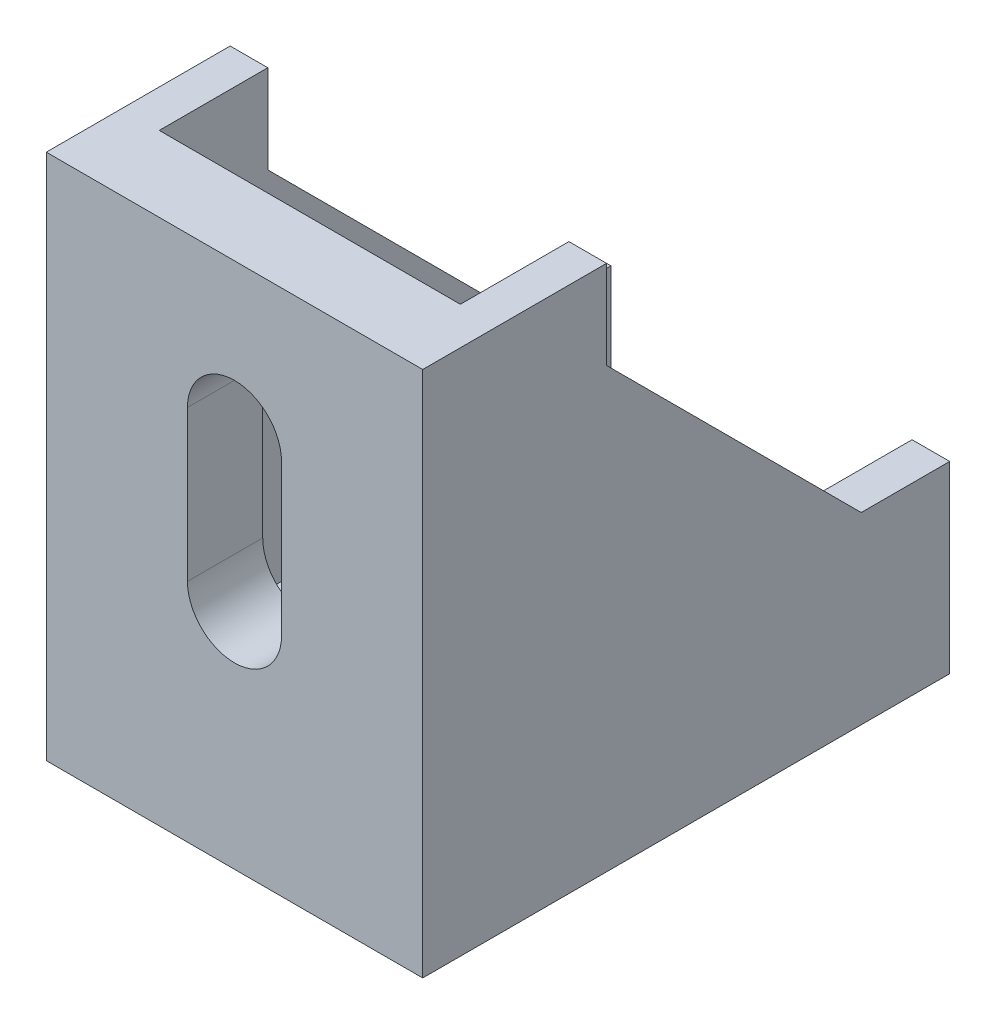
from build123d import *

# Parameters (mm, degrees)
BOSS_EXTRUDE2_DEPTH = 20
BOSS_EXTRUDE3_DEPTH = 2
BOSS_EXTRUDE4_START = 20
BOSS_EXTRUDE4_DEPTH = 2
CUT_EXTRUDE1_DEPTH  = 42.952353927
CUT_EXTRUDE2_DEPTH  = 42.952353927


with BuildPart() as part:
    # Sketch1 → Boss-Extrude2 (new body)
    with BuildSketch(Plane(origin=(0, 0, 0), x_dir=(0, 0, -1), z_dir=(1, 0, 0))):
        Polygon((0, 28), (0, 0), (28, 0), (28, 4), (4, 4), (4, 28), align=None)
    extrude(amount=BOSS_EXTRUDE2_DEPTH)

    # Sketch1<4> → Boss-Extrude3 (add)
    with BuildSketch(Plane(origin=(0, 0, 0), x_dir=(0, 0, -1), z_dir=(1, 0, 0))):
        Polygon((9.768810499, 28), (4, 28), (4, 4), (28, 4), (28, 9.768810499), (23.299944734, 9.768810499), (9.768810499, 23.299944734), align=None)
    extrude(amount=BOSS_EXTRUDE3_DEPTH)

    # Sketch1<5> → Boss-Extrude4 (add)
    with BuildSketch(Plane(origin=(0, 0, 0), x_dir=(0, 0, -1), z_dir=(1, 0, 0)).offset(BOSS_EXTRUDE4_START)):
        Polygon((9.768810499, 28), (4, 28), (4, 4), (28, 4), (28, 9.768810499), (23.299944734, 9.768810499), (9.768810499, 23.299944734), align=None)
    extrude(amount=-BOSS_EXTRUDE4_DEPTH)

    # Sketch2 → Cut-Extrude1 (cut, through all)
    with BuildSketch(Plane(origin=(0, 4, 0), x_dir=(1, 0, 0), z_dir=(0, 1, 0))):
        with BuildLine():
            Line((7.5, 12), (7.5, 20))
            ThreePointArc((7.5, 20), (10, 22.5), (12.5, 20))
            Line((12.5, 20), (12.5, 12))
            ThreePointArc((12.5, 12), (10, 9.5), (7.5, 12))
        make_face()
    extrude(amount=-CUT_EXTRUDE1_DEPTH, mode=Mode.SUBTRACT)

    # Sketch4 → Cut-Extrude2 (cut, through all)
    with BuildSketch(Plane(origin=(0, 0, -4), x_dir=(-1, 0, 0), z_dir=(0, 0, -1))):
        with BuildLine():
            Line((-12.5, 12), (-12.5, 20))
            ThreePointArc((-12.5, 20), (-10, 22.5), (-7.5, 20))
            Line((-7.5, 20), (-7.5, 12))
            ThreePointArc((-7.5, 12), (-10, 9.5), (-12.5, 12))
        make_face()
    extrude(amount=-CUT_EXTRUDE2_DEPTH, mode=Mode.SUBTRACT)


solid = part.part
